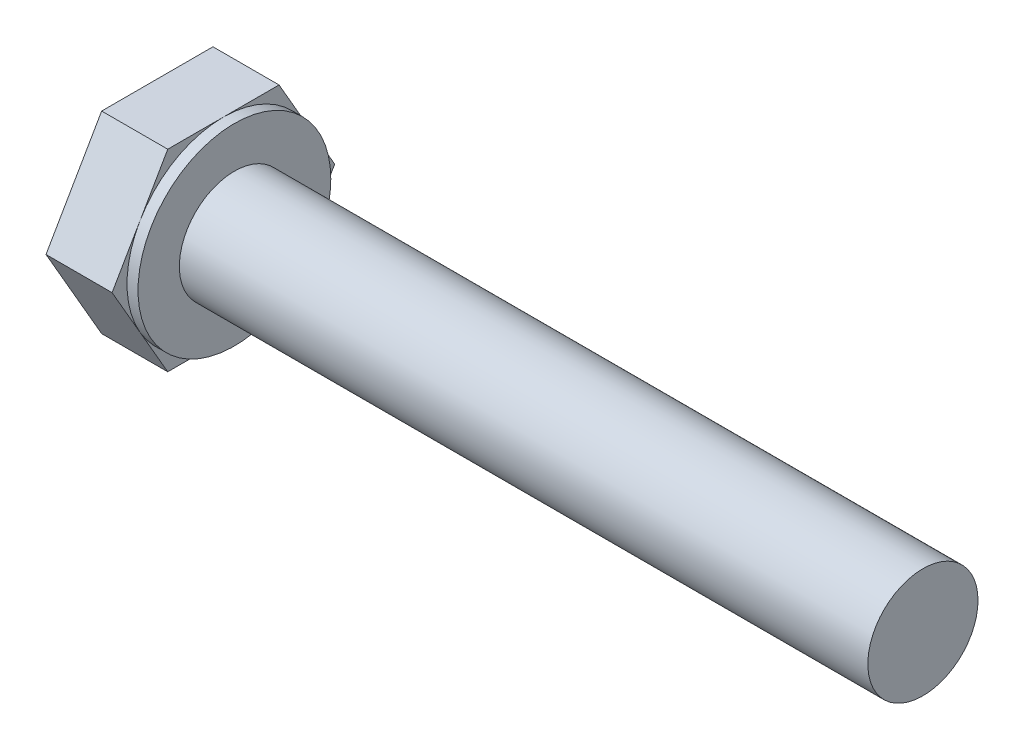
from build123d import *

# Parameters (mm, degrees)
BOSS_EXTRUDE1_DEPTH = 2.4
SKETCH2_R           = 3.5
BOSS_EXTRUDE2_DEPTH = 0.4
SKETCH3_R           = 2
BOSS_EXTRUDE3_DEPTH = 25


with BuildPart() as part:
    # Sketch1 → Boss-Extrude1 (new body)
    with BuildSketch(Plane(origin=(0, 0, 0), x_dir=(0, 0, -1), z_dir=(1, 0, 0))):
        Polygon((-4.041451884, 0), (-2.020725942, -3.5), (2.020725942, -3.5), (4.041451884, 0), (2.020725942, 3.5), (-2.020725942, 3.5), align=None)
    extrude(amount=-BOSS_EXTRUDE1_DEPTH)

    # Sketch2 → Boss-Extrude2 (add)
    with BuildSketch(Plane(origin=(0, 0, 0), x_dir=(0, 0, -1), z_dir=(1, 0, 0))):
        with Locations(Location((0, 0, 0), (0, 0, 150))):
            Circle(SKETCH2_R)
    extrude(amount=BOSS_EXTRUDE2_DEPTH)

    # Sketch3 → Boss-Extrude3 (add)
    with BuildSketch(Plane(origin=(0.4, 0, 0), x_dir=(0, 0, -1), z_dir=(1, 0, 0))):
        Circle(SKETCH3_R)
    extrude(amount=BOSS_EXTRUDE3_DEPTH)


solid = part.part
